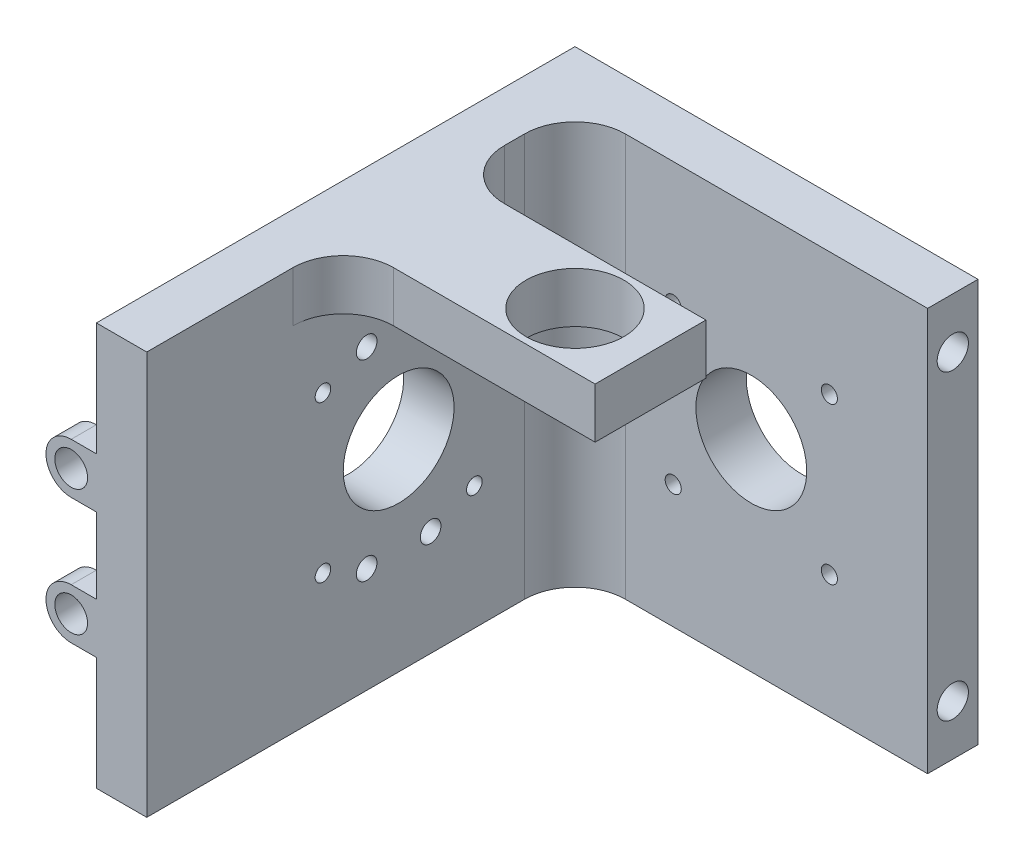
from build123d import *

# Parameters (mm, degrees)
SKETCH1_W               = 10
SKETCH1_H               = 95
BOSS_EXTRUDE1_DEPTH     = 40
SKETCH4_W               = 10
SKETCH4_H               = 80
BOSS_EXTRUDE3_DEPTH     = 70
SKETCH10_R              = 11
SKETCH10_R_2            = 1.6
CUT_EXTRUDE1_DEPTH      = 10
SKETCH2_R               = 11
SKETCH2_R_2             = 1.55
SKETCH2_R_3             = 2.05
CUT_EXTRUDE2_DEPTH      = 10
BOSS_EXTRUDE4_DEPTH     = 5
SKETCH15_R              = 3.25
CUT_EXTRUDE3_DEPTH      = 5
CROQUIS1_W              = 50
CROQUIS1_H              = 22
CROQUIS1_R              = 9.72345
SALIENTE_EXTRUIR1_DEPTH = 10
CROQUIS2_R              = 3.1
CORTAR_EXTRUIR1_DEPTH   = 7
REDONDEO1_R             = 10


with BuildPart() as part:
    # Sketch1 → Boss-Extrude1 (new, symmetric)
    with BuildSketch(Plane(origin=(0, 0, 0), x_dir=(1, 0, 0), z_dir=(0, 1, 0))):
        with Locations((-5, -1.933942264)):
            Rectangle(SKETCH1_W, SKETCH1_H)
    extrude(amount=BOSS_EXTRUDE1_DEPTH, both=True)

    # Sketch4 → Boss-Extrude3 (add)
    with BuildSketch(Plane(origin=(0, 0, 0), x_dir=(0, 0, -1), z_dir=(1, 0, 0))):
        with Locations((40.566057736, 0)):
            Rectangle(SKETCH4_W, SKETCH4_H)
    extrude(amount=BOSS_EXTRUDE3_DEPTH)

    # Sketch10 → Cut-Extrude1 (cut)
    with BuildSketch(Plane(origin=(0, 0, -45.566057736), x_dir=(-1, 0, 0), z_dir=(0, 0, -1))):
        with Locations((-35, 0)):
            Circle(SKETCH10_R)
        with Locations((-19.5, 15.5)):
            Circle(SKETCH10_R_2)
        with Locations((-50.5, 15.5)):
            Circle(SKETCH10_R_2)
        with Locations((-19.5, -15.5)):
            Circle(SKETCH10_R_2)
        with Locations((-50.5, -15.5)):
            Circle(SKETCH10_R_2)
    extrude(amount=-CUT_EXTRUDE1_DEPTH, mode=Mode.SUBTRACT)

    # Sketch2 → Cut-Extrude2 (cut)
    with BuildSketch(Plane.ZY.offset(10)):
        with Locations((-0.566057736, 0)):
            Circle(SKETCH2_R)
        with Locations((-15.591169934, -15.5)):
            Circle(SKETCH2_R_2)
        with Locations((-6.916057736, -19.05)):
            Circle(SKETCH2_R_3)
        with Locations((-15.591169934, 15.5)):
            Circle(SKETCH2_R_2)
        with Locations((-6.916057736, 19.05)):
            Circle(SKETCH2_R_3)
        with Locations((5.783942264, 19.05)):
            Circle(SKETCH2_R_3)
        with Locations((14.459054462, 15.5)):
            Circle(SKETCH2_R_2)
        with Locations((14.459054462, -15.5)):
            Circle(SKETCH2_R_2)
        with Locations((5.783942264, -19.05)):
            Circle(SKETCH2_R_3)
    extrude(amount=-CUT_EXTRUDE2_DEPTH, mode=Mode.SUBTRACT)

    # Sketch14 → Boss-Extrude4 (add)
    with BuildSketch(Plane.XY.offset(49.433942264)):
        with BuildLine():
            Line((-15, -17.5), (-10, -17.5))
            Line((-10, -17.5), (-10, -7.5))
            Line((-10, -7.5), (-15, -7.5))
            ThreePointArc((-15, -7.5), (-20, -12.5), (-15, -17.5))
        make_face()
        with BuildLine():
            Line((-15, 7.5), (-10, 7.5))
            Line((-10, 7.5), (-10, 17.5))
            Line((-10, 17.5), (-15, 17.5))
            ThreePointArc((-15, 17.5), (-20, 12.5), (-15, 7.5))
        make_face()
    extrude(amount=-BOSS_EXTRUDE4_DEPTH)

    # Sketch15 → Cut-Extrude3 (cut)
    with BuildSketch(Plane(origin=(0, 0, 44.433942264), x_dir=(-1, 0, 0), z_dir=(0, 0, -1))):
        with Locations((15, -12.5)):
            Circle(SKETCH15_R)
        with Locations((15, 12.5)):
            Circle(SKETCH15_R)
    extrude(amount=-CUT_EXTRUDE3_DEPTH, mode=Mode.SUBTRACT)

    # Croquis1 → Saliente-Extruir1 (add)
    with BuildSketch(Plane(origin=(0, 40, 0), x_dir=(1, 0, 0), z_dir=(0, 1, 0))):
        with Locations((25, 0.566057736)):
            Rectangle(CROQUIS1_W, CROQUIS1_H)
        with Locations(Location((35, 0.566057736, 0), (0, 0, 270))):
            Circle(CROQUIS1_R, mode=Mode.SUBTRACT)
    extrude(amount=-SALIENTE_EXTRUIR1_DEPTH)

    # Croquis2 → Cortar-Extruir1 (cut)
    with BuildSketch(Plane(origin=(70, 0, 0), x_dir=(0, 0, -1), z_dir=(1, 0, 0))):
        with Locations((40.566057736, 30)):
            Circle(CROQUIS2_R)
        with Locations((40.566057736, -30)):
            Circle(CROQUIS2_R)
    extrude(amount=-CORTAR_EXTRUIR1_DEPTH, mode=Mode.SUBTRACT)

    # Redondeo1
    redondeo1_edges = [part.edges().sort_by_distance(p)[0] for p in [
        (0, 0, -35.566057736),
        (0, 35, -11.566057736),
        (0, 35, 10.433942264),
    ]]
    fillet(redondeo1_edges, radius=REDONDEO1_R)


solid = part.part
